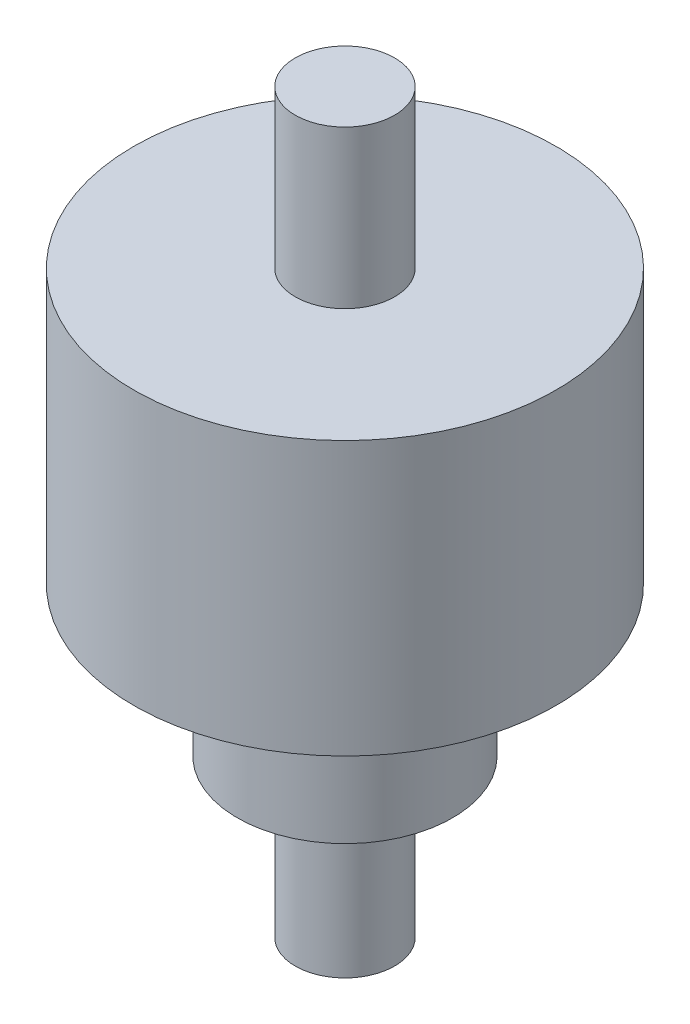
from build123d import *


with BuildPart() as part:
    # Sketch1 → Revolve1 (revolve)
    with BuildSketch(Plane.XY, mode=Mode.PRIVATE) as revolve1_sk:
        Polygon((25.5, 0), (25.5, 33), (6, 33), (6, 52), (0, 52), (0, -37), (6, -37), (6, -18), (13, -18), (13, 0), align=None)
    revolve(revolve1_sk.sketch.rotate(Axis((0, 52, 0), (0, -1, 0)), 180), axis=Axis((0, 52, 0), (0, -1, 0)))


solid = part.part
